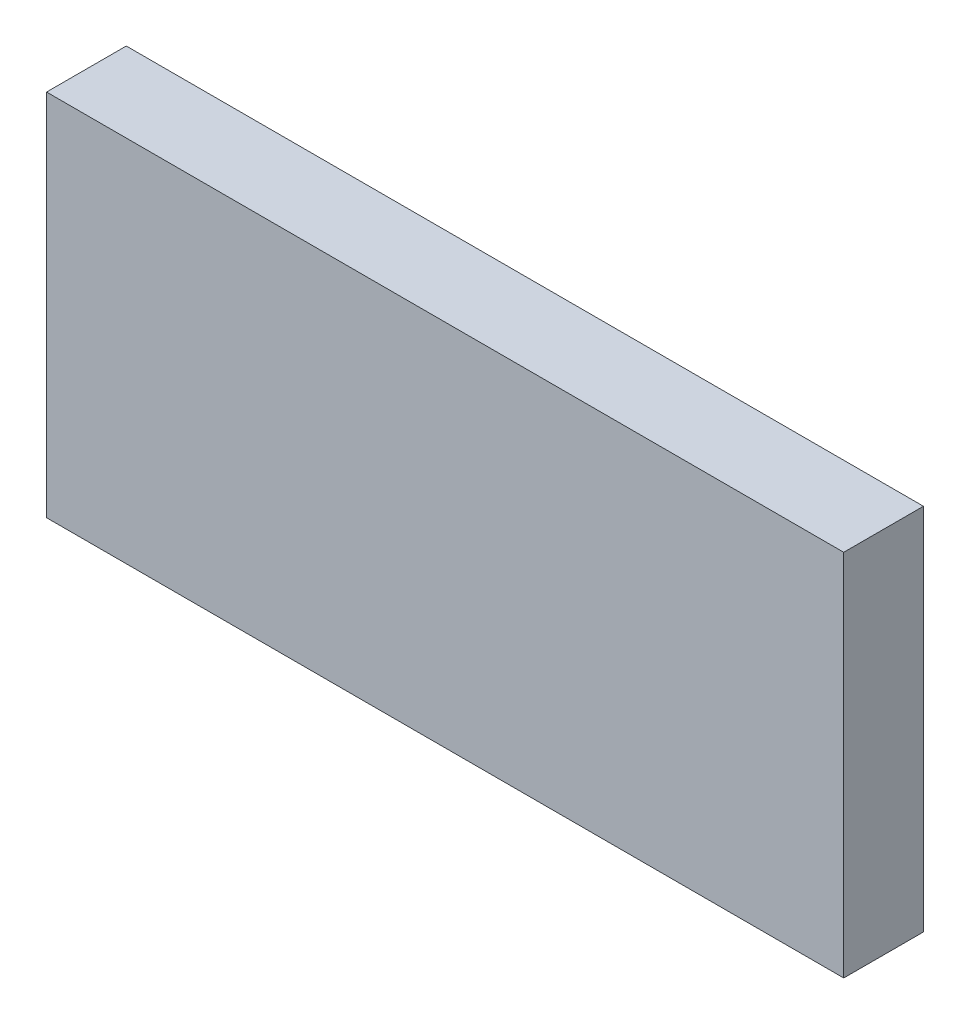
from build123d import *

# Parameters (mm, degrees)
SKETCH1_W           = 40
SKETCH1_H           = 18.5
BOSS_EXTRUDE1_DEPTH = 4


with BuildPart() as part:
    # Sketch1 → Boss-Extrude1 (new body)
    with BuildSketch(Plane.XY):
        Rectangle(SKETCH1_W, SKETCH1_H)
    extrude(amount=BOSS_EXTRUDE1_DEPTH)


solid = part.part
